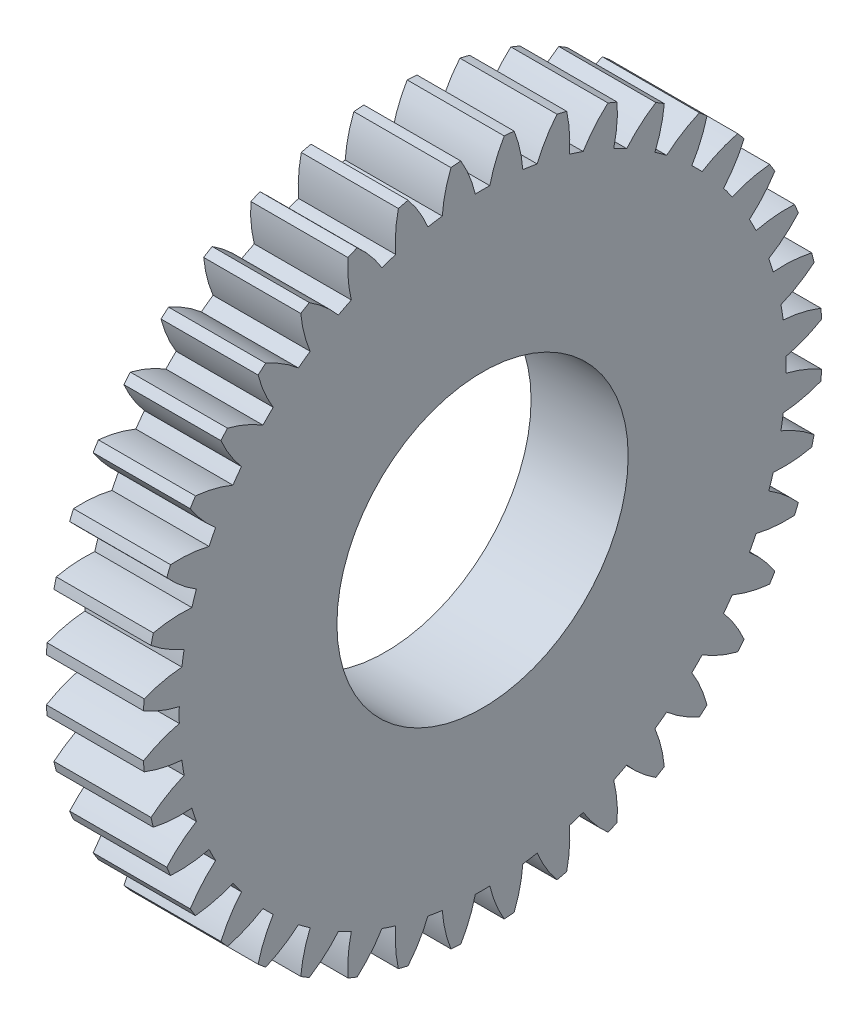
from build123d import *

# Parameters (mm, degrees)
BASPROSKE_W     = 3
BASPROSKE_H     = 10.5
TOOTHCUT_DEPTH  = 16.149257408
TEETHCUTS_COUNT = 40
TEETHCUTS_ANGLE = 351
BORSKE_R        = 4.5
BORE_DEPTH      = 50.0000508


with BuildPart() as part:
    # BasProSke → Base-Revolve (revolve)
    with BuildSketch(Plane(origin=(0, 0, 0), x_dir=(1, 0, 0), z_dir=(0, 1, 0)), mode=Mode.PRIVATE) as base_revolve_sk:
        with Locations((1.5, 5.25)):
            Rectangle(BASPROSKE_W, BASPROSKE_H)
    revolve(base_revolve_sk.sketch.rotate(Axis((-10, 0, 0), (1, 0, 0)), 180), axis=Axis((-10, 0, 0), (1, 0, 0)))

    # TooCutSke → ToothCut (cut, through all)
    with BuildSketch(Plane(origin=(0, 0, 0), x_dir=(0, 0, -1), z_dir=(1, 0, 0))):
        with BuildLine():
            ThreePointArc((0.22421855, 9.371318053), (0, 9.374), (-0.22421855, 9.371318053))
            ThreePointArc((-0.22421855, 9.371318053), (-0.410979984, 9.954898379), (-0.684682827, 10.503106902))
            ThreePointArc((-0.684682827, 10.503106902), (0, 10.5254), (0.684682827, 10.503106902))
            ThreePointArc((0.684682827, 10.503106902), (0.410979984, 9.954898379), (0.22421855, 9.371318053))
        make_face()
    toothcut = extrude(amount=TOOTHCUT_DEPTH, mode=Mode.SUBTRACT)

    # TeethCuts: ToothCut ×40 about axis
    teethcuts_axis = Axis((-10, 0, 0), (1, 0, 0))
    for i in range(1, TEETHCUTS_COUNT):
        add(toothcut.rotate(teethcuts_axis, i * TEETHCUTS_ANGLE / (TEETHCUTS_COUNT - 1)), mode=Mode.SUBTRACT)

    # BorSke → Bore (cut, symmetric)
    with BuildSketch(Plane(origin=(0, 0, 0), x_dir=(0, 0, -1), z_dir=(1, 0, 0))):
        with Locations(Location((0, 0, 0), (0, 0, 180))):
            Circle(BORSKE_R)
    extrude(amount=BORE_DEPTH, both=True, mode=Mode.SUBTRACT)


solid = part.part
